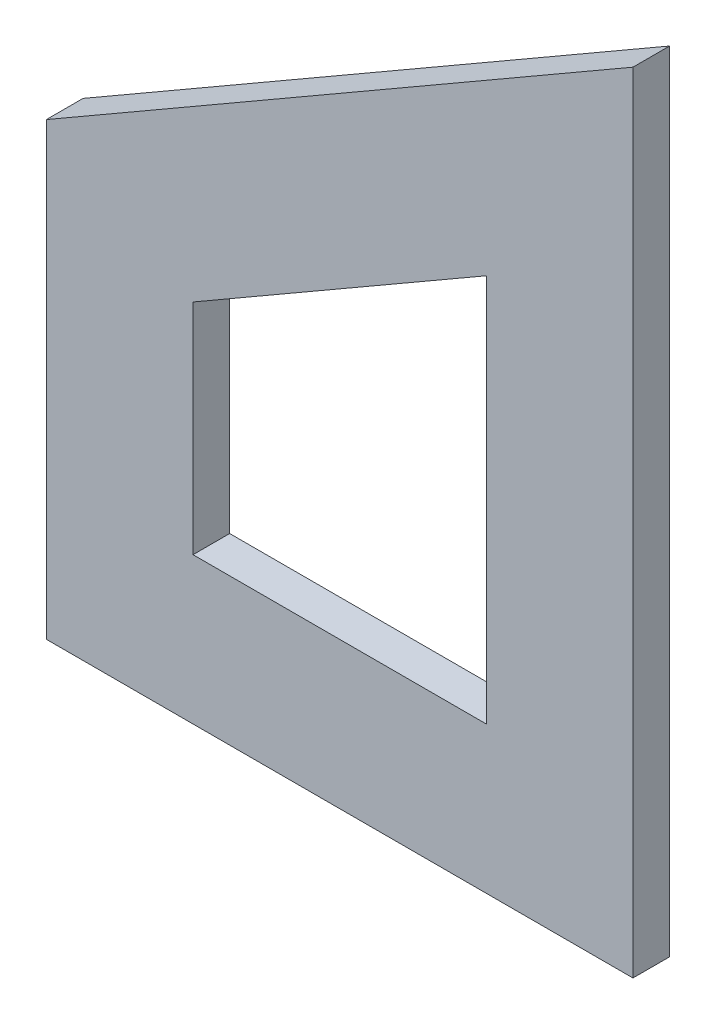
from build123d import *

# Parameters (mm, degrees)
BOSS_EXTRUDE1_DEPTH = 3.175
CUT_EXTRUDE1_DEPTH  = 267.323293548


with BuildPart() as part:
    # Sketch1 → Boss-Extrude1 (new, symmetric)
    with BuildSketch(Plane.XY):
        Polygon((-130.838522478, 95.25), (-29.238522478, 95.25), (-29.238522478, 231.881554295), (-130.838522478, 173.222766945), align=None)
    extrude(amount=BOSS_EXTRUDE1_DEPTH, both=True)

    # Sketch2 → Cut-Extrude1 (cut, through all)
    with BuildSketch(Plane.XY.offset(3.175)):
        Polygon((-54.638522478, 120.65), (-54.638522478, 187.887463782), (-105.438522478, 158.558070107), (-105.438522478, 120.65), align=None)
    extrude(amount=-CUT_EXTRUDE1_DEPTH, mode=Mode.SUBTRACT)


solid = part.part
